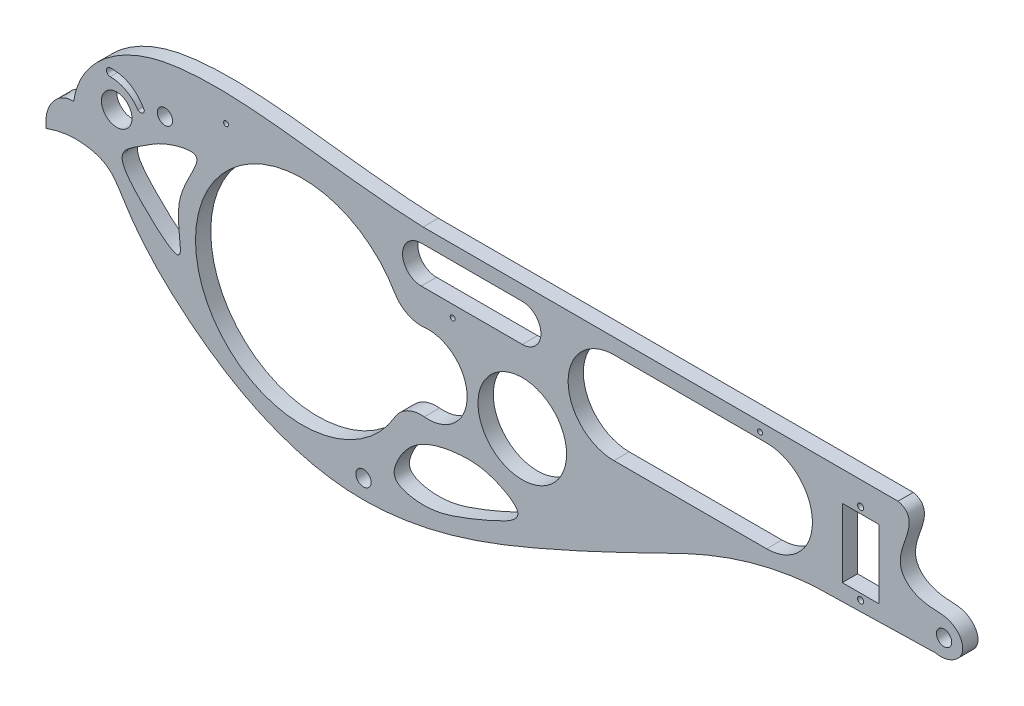
from build123d import *

# Parameters (mm, degrees)
SKETCH3_R           = 5
SKETCH3_R_2         = 14.5
SKETCH3_R_3         = 2.5
SKETCH3_R_4         = 0.8
SKETCH3_R_5         = 1
SKETCH3_W           = 12
SKETCH3_H           = 22.5
BOSS_EXTRUDE1_DEPTH = 5


with BuildPart() as part:
    # Sketch3 → Boss-Extrude1 (new body)
    with BuildSketch(Plane.XY):
        with BuildLine():
            Line((130.202207667, 133.648137476), (285.7113551, 133.648137476))
            add(Edge.make_bspline(
                [(285.7113551, 133.648137476), (290.309231982, 132.614090904), (289.273428409, 126.547289319), (286.708075229, 120.48453562), (286.086765627, 115.372579006), (289.446515851, 110.522413853), (295.757028465, 108.540096459), (302.900755451, 109.128946912), (306.938482979, 104.870613349), (306.965344479, 98.499192812), (301.299570036, 95.836843498), (298.194388489, 96.769170109)],
                knots=[0, 0, 0, 0, 0.169883356, 0.267904652, 0.35910195, 0.418587956, 0.560719914, 0.67952393, 0.781873649, 0.818154072, 1, 1, 1, 1], degree=3))
            Line((298.194388489, 96.769170109), (258.822035056, 95.837280087))
            add(Edge.make_bspline(
                [(258.822035056, 95.837280087), (247.017312141, 95.103687357), (230.333987707, 90.718335552), (209.444238318, 80.909197853), (192.705172023, 72.506882651), (167.703009745, 61.109996502), (138.435868304, 48.871100202), (104.803872383, 44.791136534), (75.967374894, 52.877626112), (51.283170012, 69.280361811), (37.192250509, 83.974473902), (31.955350622, 92.70185845)],
                knots=[0, 0, 0, 0, 0.14025247, 0.203194064, 0.274778481, 0.363372019, 0.530716046, 0.651092977, 0.758816574, 0.879981668, 1, 1, 1, 1], degree=3))
            add(Edge.make_bspline(
                [(6.79589492, 99.88517737), (11.159659609, 101.522816847), (18.151736453, 102.517002576), (27.791925077, 99.513583762), (30.58065878, 94.935027932), (31.955350622, 92.70185845)],
                knots=[0, 0, 0, 0, 0.481672665, 0.718974517, 1, 1, 1, 1], degree=3))
            Line((6.79589492, 99.88517737), (6.79589492, 101.439514635))
            add(Edge.make_bspline(
                [(6.79589492, 101.439514635), (6.344194928, 106.476861801), (10.489323027, 112.301543457), (15.823424194, 112.07348563)],
                knots=[0, 0, 0, 0, 1, 1, 1, 1], degree=3))
            add(Edge.make_bspline(
                [(15.823424194, 112.07348563), (17.736995843, 124.940641906), (32.636875141, 136.223279448), (57.795341928, 140.118608734), (87.99874752, 138.454580265), (113.398342921, 134.237536283), (130.202207667, 133.648137476)],
                knots=[0, 0, 0, 0, 0.288569095, 0.388427256, 0.602706741, 1, 1, 1, 1], degree=3))
        make_face()
        with Locations((29.916841198, 116.77568402)):
            Circle(SKETCH3_R, mode=Mode.SUBTRACT)
        with Locations((162.706015246, 92.70185845)):
            Circle(SKETCH3_R_2, mode=Mode.SUBTRACT)
        with Locations((45.706015246, 122.70185845)):
            Circle(SKETCH3_R_3, mode=Mode.SUBTRACT)
        with Locations((110.706015246, 52.70185845)):
            Circle(SKETCH3_R_3, mode=Mode.SUBTRACT)
        with Locations((139.906015246, 112.70185845)):
            Circle(SKETCH3_R_4, mode=Mode.SUBTRACT)
        with Locations((65.706015246, 130.70185845)):
            Circle(SKETCH3_R_4, mode=Mode.SUBTRACT)
        with Locations((240.533693373, 130.70185845)):
            Circle(SKETCH3_R_4, mode=Mode.SUBTRACT)
        with Locations((273.471513959, 99.439514635)):
            Circle(SKETCH3_R_5, mode=Mode.SUBTRACT)
        with Locations((273.471513959, 125.939514635)):
            Circle(SKETCH3_R_5, mode=Mode.SUBTRACT)
        with Locations((300.79589492, 102.439514635)):
            Circle(SKETCH3_R_3, mode=Mode.SUBTRACT)
        with BuildLine():
            add(Edge.make_bspline(
                [(122.209177881, 63.920046831), (124.071143432, 67.46098543), (129.552690029, 73.076916894), (142.443318239, 75.666531835), (152.661516952, 74.969258802), (165.093978536, 67.491108066), (151.766983783, 61.075321044), (141.8940002, 57.110448814), (131.105911986, 53.626446027), (119.278132968, 56.881901514), (121.199333237, 61.999604275), (122.209177881, 63.920046831)],
                knots=[0, 0, 0, 0, 0.113321383, 0.252345048, 0.383344812, 0.473297432, 0.574795831, 0.703340207, 0.858328251, 0.938539683, 1, 1, 1, 1], degree=3))
        make_face(mode=Mode.SUBTRACT)
        with BuildLine():
            add(Edge.make_bspline(
                [(55.569109559, 116.77568402), (58.06486019, 115.40751755), (46.221835448, 102.100129237), (54.755702164, 78.95610702), (37.80335454, 94.115669857), (28.908160657, 105.04797482), (38.772452492, 110.799390458), (44.727609723, 115.267642921), (54.017868755, 117.626071727), (55.569109559, 116.77568402)],
                knots=[0, 0, 0, 0, 0.187258806, 0.369366525, 0.564056852, 0.688544956, 0.776357377, 0.883608764, 1, 1, 1, 1], degree=3))
        make_face(mode=Mode.SUBTRACT)
        with BuildLine():
            Line((129.600178714, 128.800296002), (162.706015246, 128.800296002))
            ThreePointArc((162.706015246, 128.800296002), (168.804452797, 122.70185845), (162.706015246, 116.603420898))
            Line((162.706015246, 116.603420898), (129.600178714, 116.603420898))
            ThreePointArc((129.600178714, 116.603420898), (123.501741162, 122.70185845), (129.600178714, 128.800296002))
        make_face(mode=Mode.SUBTRACT)
        with BuildLine():
            Line((192.706015246, 128.648137476), (242.706015246, 128.648137476))
            ThreePointArc((242.706015246, 128.648137476), (257.706015246, 113.648137476), (242.706015246, 98.648137476))
            Line((242.706015246, 98.648137476), (192.706015246, 98.648137476))
            ThreePointArc((192.706015246, 98.648137476), (177.706015246, 113.648137476), (192.706015246, 128.648137476))
        make_face(mode=Mode.SUBTRACT)
        with Locations((273.471513959, 112.689514635)):
            Rectangle(SKETCH3_W, SKETCH3_H, mode=Mode.SUBTRACT)
        with BuildLine():
            ThreePointArc((120.957031276, 110.305154423), (55.706015246, 92.70185845), (120.957031276, 75.098562477))
            ThreePointArc((120.957031276, 75.098562477), (125.061260284, 78.979617196), (130.61373477, 80.017551949))
            ThreePointArc((130.61373477, 80.017551949), (144.655980745, 92.70185845), (130.61373477, 105.386164951))
            ThreePointArc((130.61373477, 105.386164951), (125.061260284, 106.424099704), (120.957031276, 110.305154423))
        make_face(mode=Mode.SUBTRACT)
        with BuildLine():
            ThreePointArc((27.806621893, 127.583672906), (26.556621893, 126.333672906), (27.806621893, 125.083672906))
            add(Edge.make_bspline(
                [(27.806621893, 125.083672906), (33.517614218, 124.90543335), (36.849799109, 120.182906914)],
                knots=[0, 0, 0, 1, 1, 1], degree=2))
            ThreePointArc((36.849799109, 120.182906914), (38.202830718, 119.943925504), (38.957953378, 121.091791532))
            add(Edge.make_bspline(
                [(27.806621893, 127.583672906), (35.266361108, 127.783688979), (38.957953378, 121.091791532)],
                knots=[0, 0, 0, 1, 1, 1], degree=2))
        make_face(mode=Mode.SUBTRACT)
    extrude(amount=BOSS_EXTRUDE1_DEPTH)


solid = part.part
